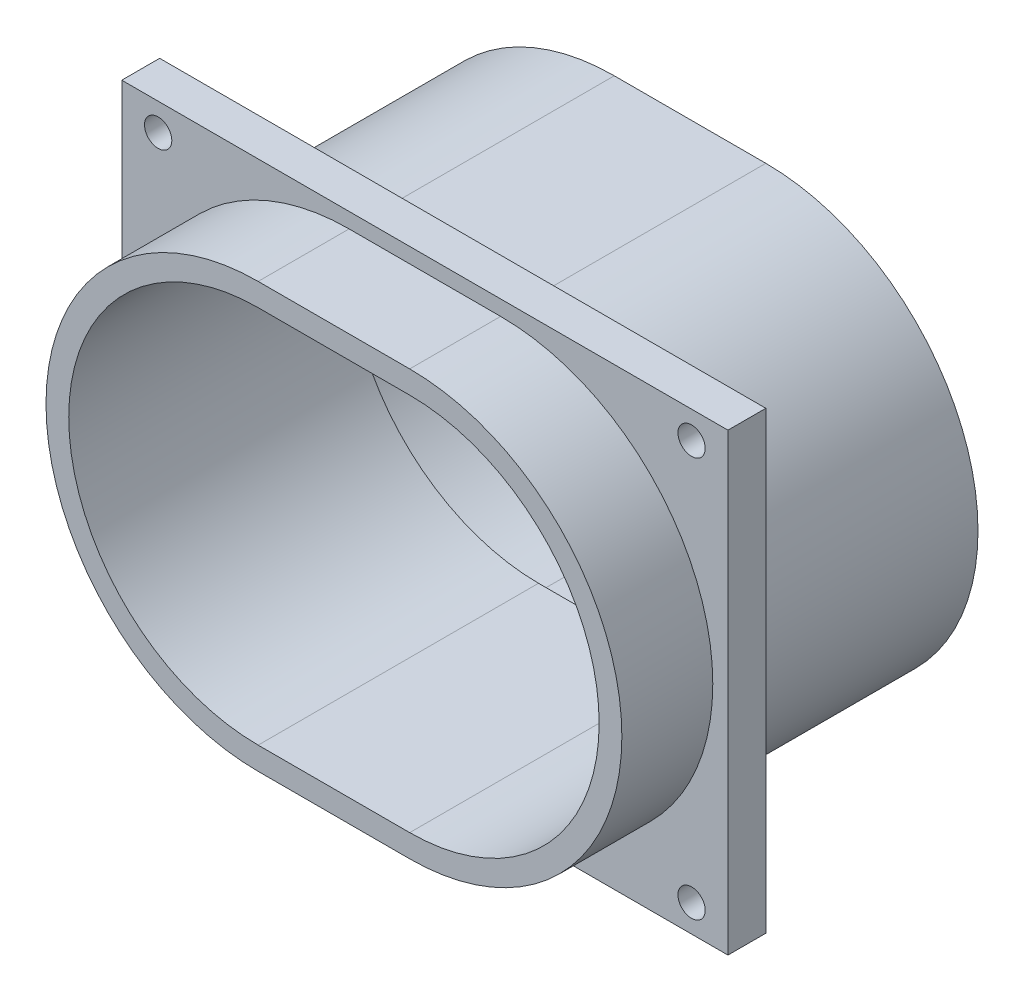
from build123d import *

# Parameters (mm, degrees)
BOSS_EXTRUDE3_DEPTH = 12
CUT_EXTRUDE1_DEPTH  = 12
SKETCH7_W           = 80
SKETCH7_H           = 60
BOSS_EXTRUDE4_DEPTH = 5
BOSS_EXTRUDE5_DEPTH = 30
SKETCH10_R          = 1.8
CUT_EXTRUDE2_DEPTH  = 30
CUT_EXTRUDE3_DEPTH  = 10


with BuildPart() as part:
    # Sketch5 → Boss-Extrude3 (new body)
    with BuildSketch(Plane.XY):
        with BuildLine():
            Line((10, -28), (-10, -28))
            ThreePointArc((-10, -28), (-38, 0), (-10, 28))
            Line((-10, 28), (10, 28))
            ThreePointArc((10, 28), (38, 0), (10, -28))
        make_face()
    extrude(amount=BOSS_EXTRUDE3_DEPTH)

    # Sketch6 → Cut-Extrude1 (cut)
    with BuildSketch(Plane.XY.offset(12)):
        with BuildLine():
            Line((10, -25), (-10, -25))
            ThreePointArc((-10, -25), (-35, 0), (-10, 25))
            Line((-10, 25), (10, 25))
            ThreePointArc((10, 25), (35, 0), (10, -25))
        make_face()
    extrude(amount=-CUT_EXTRUDE1_DEPTH, mode=Mode.SUBTRACT)

    # Sketch7 → Boss-Extrude4 (add)
    with BuildSketch(Plane(origin=(0, 0, 0), x_dir=(-1, 0, 0), z_dir=(0, 0, -1))):
        Rectangle(SKETCH7_W, SKETCH7_H)
        with BuildLine():
            Line((10, -25), (-10, -25))
            ThreePointArc((-10, -25), (-35, 0), (-10, 25))
            Line((-10, 25), (10, 25))
            ThreePointArc((10, 25), (35, 0), (10, -25))
        make_face(mode=Mode.SUBTRACT)
    extrude(amount=BOSS_EXTRUDE4_DEPTH)

    # Sketch9 → Boss-Extrude5 (add)
    with BuildSketch(Plane(origin=(0, 0, -5), x_dir=(-1, 0, 0), z_dir=(0, 0, -1))):
        with BuildLine():
            Line((10, -28), (-10, -28))
            ThreePointArc((-10, -28), (-38, 0), (-10, 28))
            Line((-10, 28), (10, 28))
            ThreePointArc((10, 28), (38, 0), (10, -28))
        make_face()
        with BuildLine():
            Line((10, -25), (-10, -25))
            ThreePointArc((-10, -25), (-35, 0), (-10, 25))
            Line((-10, 25), (10, 25))
            ThreePointArc((10, 25), (35, 0), (10, -25))
        make_face(mode=Mode.SUBTRACT)
    extrude(amount=BOSS_EXTRUDE5_DEPTH)

    # Sketch10 → Cut-Extrude2 (cut)
    with BuildSketch(Plane(origin=(0, 0, -5), x_dir=(-1, 0, 0), z_dir=(0, 0, -1))):
        with Locations((-35.2, 26.4)):
            Circle(SKETCH10_R)
        with Locations((35.2, 26.4)):
            Circle(SKETCH10_R)
        with Locations((35.2, -26.4)):
            Circle(SKETCH10_R)
        with Locations((-35.2, -26.4)):
            Circle(SKETCH10_R)
    extrude(amount=-CUT_EXTRUDE2_DEPTH, mode=Mode.SUBTRACT)

    # Sketch11 → Cut-Extrude3 (cut)
    with BuildSketch(Plane(origin=(0, 0, -35), x_dir=(-1, 0, 0), z_dir=(0, 0, -1))):
        with BuildLine():
            Line((10, -26), (-10, -26))
            ThreePointArc((-10, -26), (-36, 0), (-10, 26))
            Line((-10, 26), (10, 26))
            ThreePointArc((10, 26), (36, 0), (10, -26))
        make_face()
    extrude(amount=-CUT_EXTRUDE3_DEPTH, mode=Mode.SUBTRACT)


solid = part.part
